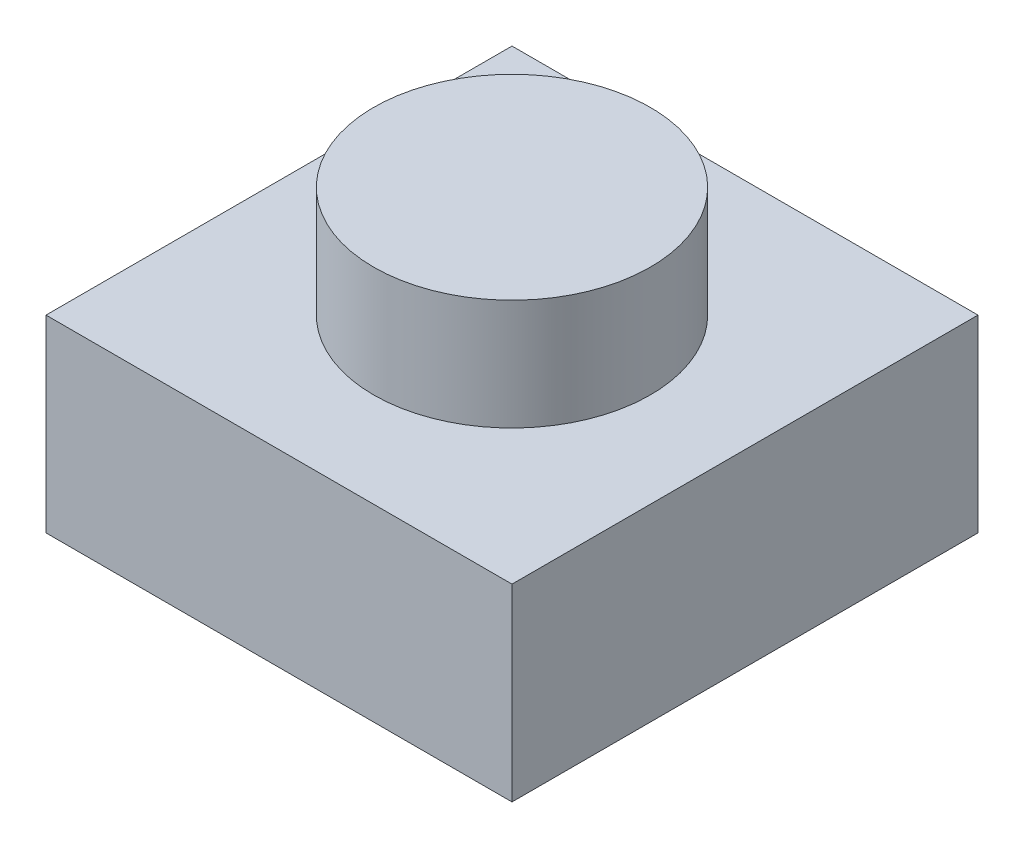
from build123d import *

# Parameters (mm, degrees)
SKETCH1_W           = 7.83
SKETCH1_H           = 7.83
BOSS_EXTRUDE1_DEPTH = 3.17
SKETCH2_R           = 2.325
BOSS_EXTRUDE2_DEPTH = 1.86
SHELL2_T            = -1.45


with BuildPart() as part:
    # Sketch1 → Boss-Extrude1 (new body)
    with BuildSketch(Plane(origin=(0, 0, 0), x_dir=(1, 0, 0), z_dir=(0, 1, 0))):
        Rectangle(SKETCH1_W, SKETCH1_H)
    extrude(amount=-BOSS_EXTRUDE1_DEPTH)

    # Sketch2 → Boss-Extrude2 (add)
    with BuildSketch(Plane(origin=(0, 0, 0), x_dir=(1, 0, 0), z_dir=(0, 1, 0))):
        with Locations(Location((0, 0, 0), (0, 0, 270))):
            Circle(SKETCH2_R)
    extrude(amount=BOSS_EXTRUDE2_DEPTH)

    # Shell2
    shell2_openings = [part.faces().sort_by_distance(p)[0] for p in [
        (0, -3.17, 0),
    ]]
    offset(amount=SHELL2_T, openings=shell2_openings, kind=Kind.INTERSECTION)


solid = part.part
